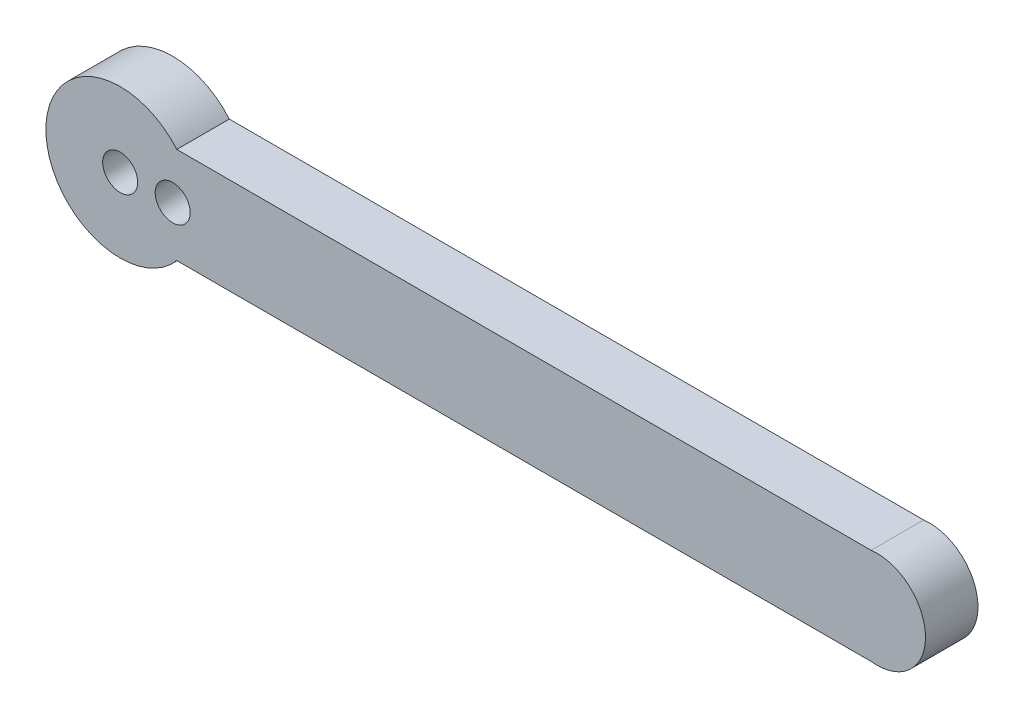
from build123d import *

# Parameters (mm, degrees)
BOSS_EXTRUDE1_DEPTH = 3
SKETCH2_R           = 1
CUT_EXTRUDE1_DEPTH  = 10


with BuildPart() as part:
    # Sketch1 → Boss-Extrude1 (new body)
    with BuildSketch(Plane.XY):
        with BuildLine():
            Line((42.897098206, 2.75), (3.234605968, 2.75))
            ThreePointArc((3.234605968, 2.75), (-4.245606643, 0), (3.234605968, -2.75))
            Line((3.234605968, -2.75), (42.897098206, -2.75))
            ThreePointArc((42.897098206, -2.75), (46.005239739, 0), (42.897098206, 2.75))
        make_face()
    extrude(amount=BOSS_EXTRUDE1_DEPTH)

    # Sketch2 → Cut-Extrude1 (cut)
    with BuildSketch(Plane.XY.offset(3)):
        Circle(SKETCH2_R)
        with Locations((3, 0)):
            Circle(SKETCH2_R)
    extrude(amount=-CUT_EXTRUDE1_DEPTH, mode=Mode.SUBTRACT)


solid = part.part
